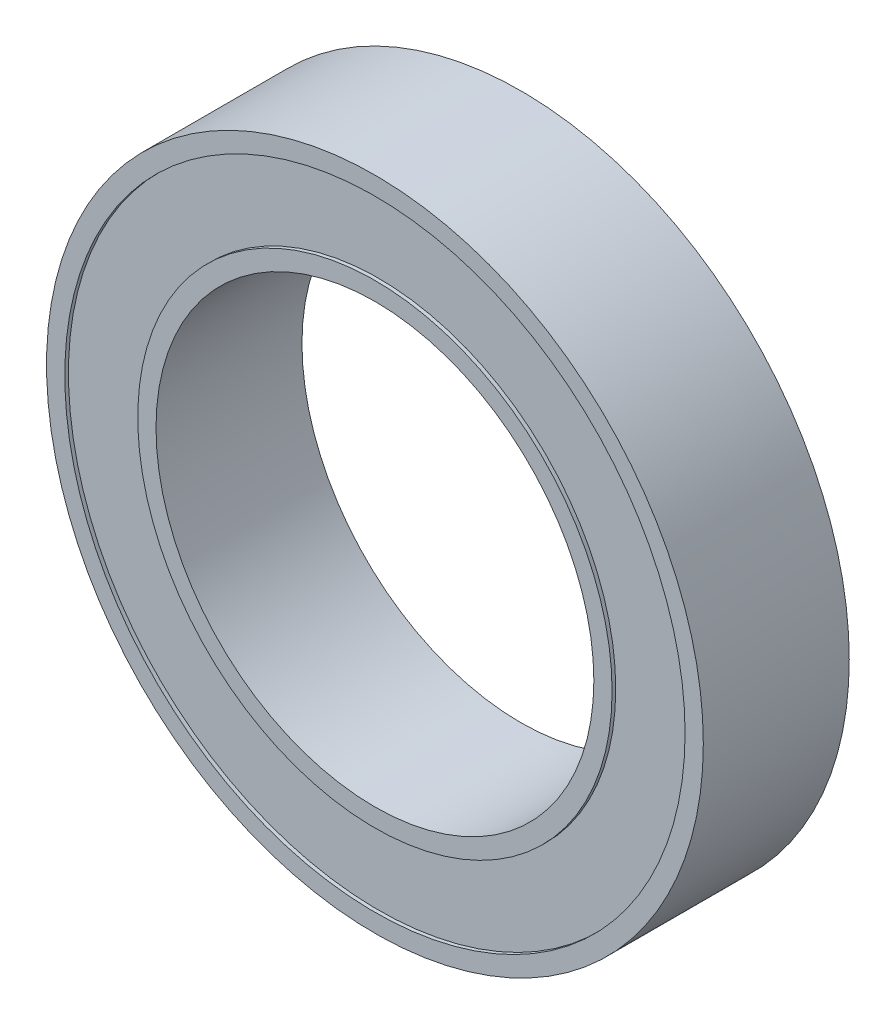
from build123d import *

# Parameters (mm, degrees)
SKETCH1_R           = 9
SKETCH1_R_2         = 6
BOSS_EXTRUDE1_DEPTH = 4
SKETCH2_R           = 8.5
SKETCH2_R_2         = 6.5
CUT_EXTRUDE1_DEPTH  = 0.1
CUT_EXTRUDE2_START  = -0.1
SKETCH3_R           = 8.5
SKETCH3_R_2         = 6.5
CUT_EXTRUDE2_DEPTH  = 0.1


with BuildPart() as part:
    # Sketch1 → Boss-Extrude1 (new body)
    with BuildSketch(Plane.XY):
        Circle(SKETCH1_R)
        Circle(SKETCH1_R_2, mode=Mode.SUBTRACT)
    extrude(amount=BOSS_EXTRUDE1_DEPTH)

    # Sketch2 → Cut-Extrude1 (cut)
    with BuildSketch(Plane(origin=(0, 0, 0), x_dir=(-1, 0, 0), z_dir=(0, 0, -1))):
        Circle(SKETCH2_R)
        Circle(SKETCH2_R_2, mode=Mode.SUBTRACT)
    extrude(amount=-CUT_EXTRUDE1_DEPTH, mode=Mode.SUBTRACT)

    # Sketch3 → Cut-Extrude2 (cut)
    with BuildSketch(Plane.XY.offset(4).offset(CUT_EXTRUDE2_START)):
        with Locations(Location((0, 0, 0), (0, 0, 180))):
            Circle(SKETCH3_R)
        with Locations(Location((0, 0, 0), (0, 0, 180))):
            Circle(SKETCH3_R_2, mode=Mode.SUBTRACT)
    extrude(amount=CUT_EXTRUDE2_DEPTH, mode=Mode.SUBTRACT)


solid = part.part
